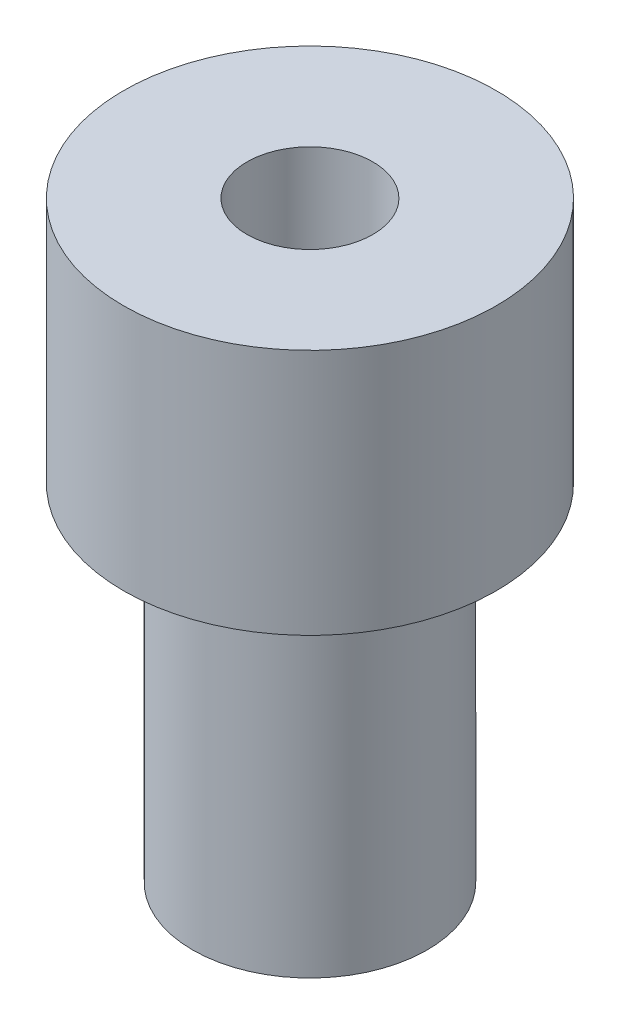
from build123d import *

# Parameters (mm, degrees)
CHAMFER1_SIZE = 0.4


with BuildPart() as part:
    # Sketch1 → Revolve1 (revolve)
    with BuildSketch(Plane.XY, mode=Mode.PRIVATE) as revolve1_sk:
        Polygon((-2.55, 0), (-2.55, 24), (-7.55, 24), (-7.55, 14), (-4.75, 14), (-4.75, 0), align=None)
    revolve(revolve1_sk.sketch.rotate(Axis((0, 5.173411558, 0), (0, -1, 0)), 270), axis=Axis((0, 5.173411558, 0), (0, -1, 0)))

    # Chamfer1
    chamfer1_edges = [part.edges().sort_by_distance(p)[0] for p in [
        (0, 14, -4.75),
    ]]
    chamfer(chamfer1_edges, length=CHAMFER1_SIZE)


solid = part.part
